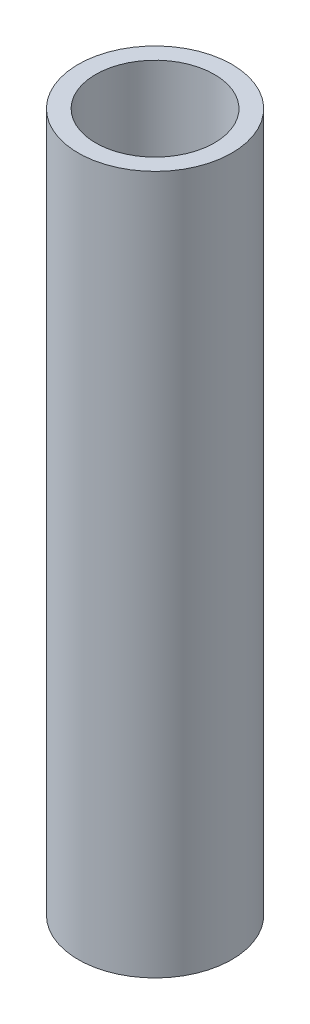
from build123d import *

# Parameters (mm, degrees)
SKETCH1_R           = 16.764
SKETCH1_R_2         = 12.954
BOSS_EXTRUDE1_DEPTH = 152.4


with BuildPart() as part:
    # Sketch1 → Boss-Extrude1 (new body)
    with BuildSketch(Plane(origin=(0, 0, 0), x_dir=(1, 0, 0), z_dir=(0, 1, 0))):
        with Locations(Location((0, 0, 0), (0, 0, 90))):
            Circle(SKETCH1_R)
        with Locations(Location((0, 0, 0), (0, 0, 90))):
            Circle(SKETCH1_R_2, mode=Mode.SUBTRACT)
    extrude(amount=BOSS_EXTRUDE1_DEPTH)


solid = part.part
